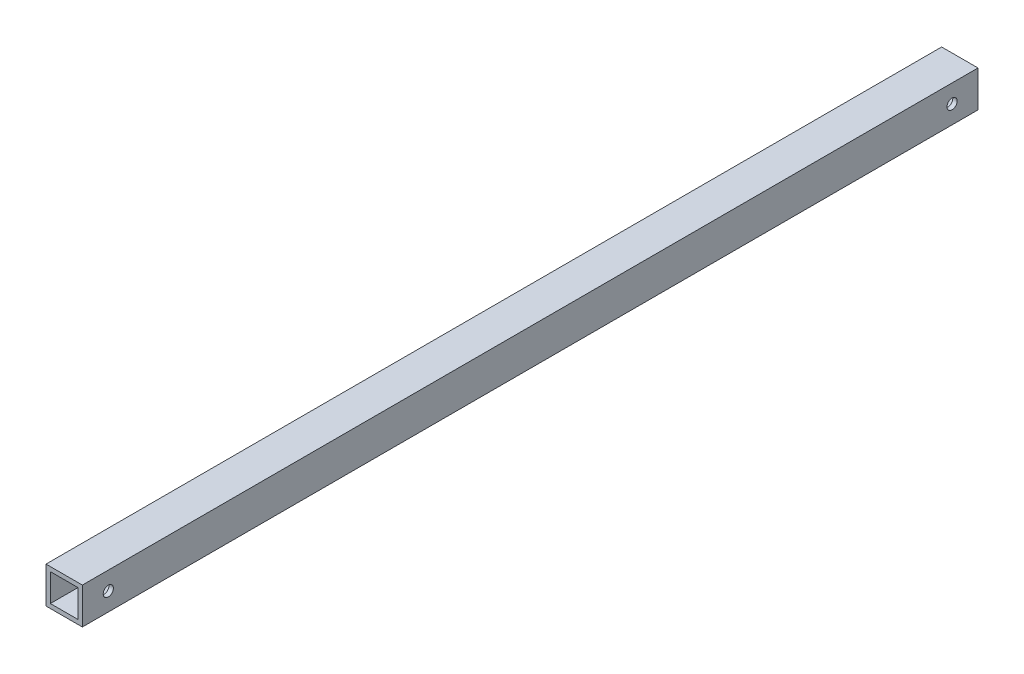
from build123d import *

# Parameters (mm, degrees)
SKETCH_1_W             = 25
SKETCH_1_H             = 25
SKETCH_1_W_2           = 19
SKETCH_1_H_2           = 19
EXTRUDE_1_DEPTH        = 616
HOLE_WIZARD_7_0_7_1_D  = 7
PATTERN_LINEAR_1_COUNT = 2
PATTERN_LINEAR_1_PITCH = 580.3


with BuildPart() as part:
    # 草图1 → 拉伸1 (new body)
    with BuildSketch(Plane.XY):
        with Locations((12.5, -12.5)):
            Rectangle(SKETCH_1_W, SKETCH_1_H)
        with Locations((12.5, -12.5)):
            Rectangle(SKETCH_1_W_2, SKETCH_1_H_2, mode=Mode.SUBTRACT)
    extrude(amount=EXTRUDE_1_DEPTH)

    # Ø7.0 (7) 直径孔1 (through all)
    with Locations(Plane(origin=(25, 0, 0), x_dir=(0, 0, -1), z_dir=(1, 0, 0))):
        with Locations((-598.15, -12.5)):
            hole_wizard_7_0_7_1 = Hole(HOLE_WIZARD_7_0_7_1_D / 2)

    # 阵列(线性)1: Ø7.0 (7) 直径孔1 ×2
    with Locations(*[(0, 0, -i * PATTERN_LINEAR_1_PITCH) for i in range(1, PATTERN_LINEAR_1_COUNT)]):
        add(hole_wizard_7_0_7_1, mode=Mode.SUBTRACT)


solid = part.part
